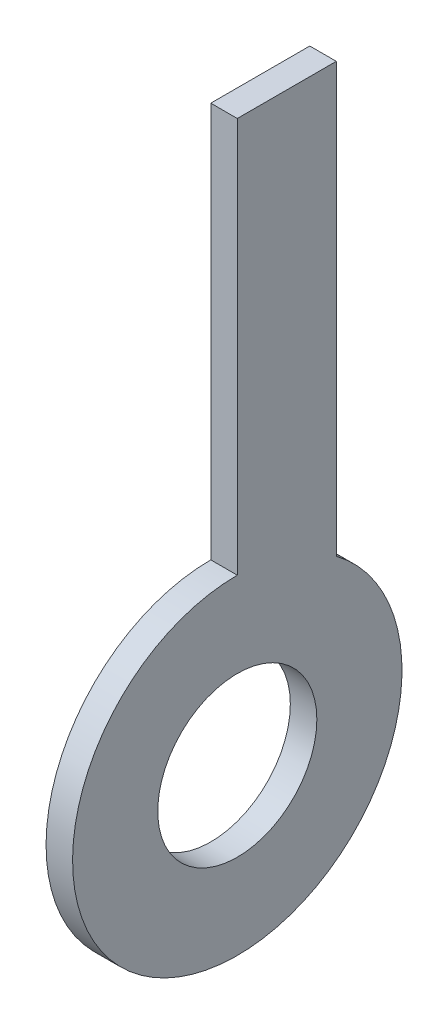
from build123d import *

# Parameters (mm, degrees)
SKETCH_1_R      = 6
EXTRUDE_1_DEPTH = 2


with BuildPart() as part:
    # 草图1 → 凸台-拉伸1 (new body)
    with BuildSketch(Plane(origin=(0, 0, 0), x_dir=(0, 0, -1), z_dir=(1, 0, 0))):
        with BuildLine():
            Line((0, 12.420554127), (0, 42.248889833))
            Line((0, 42.248889833), (7.466143224, 42.248889833))
            Line((7.466143224, 42.248889833), (7.466143224, 9.926070229))
            ThreePointArc((7.466143224, 9.926070229), (-3.935916176, -11.780438391), (0, 12.420554127))
        make_face()
        Circle(SKETCH_1_R, mode=Mode.SUBTRACT)
    extrude(amount=EXTRUDE_1_DEPTH)


solid = part.part
